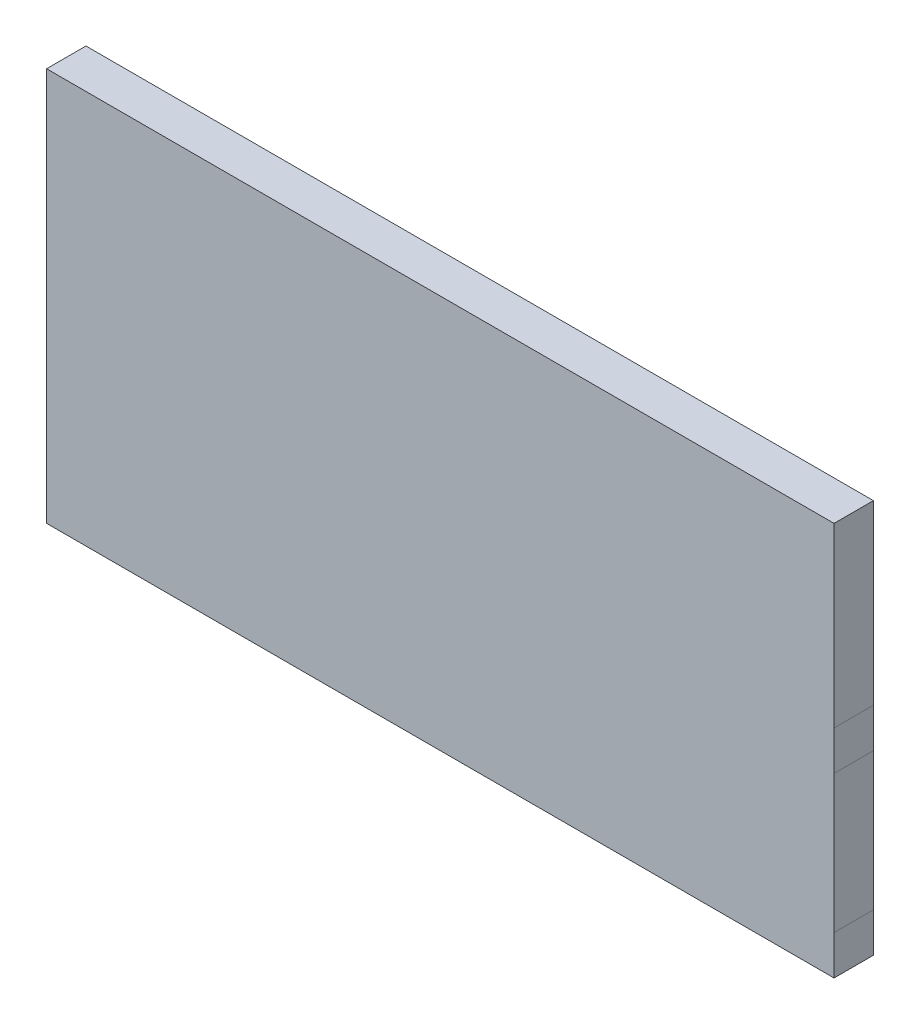
from build123d import *

# Parameters (mm, degrees)
SKETCH1_W           = 2000
SKETCH1_H           = 1000
BOSS_EXTRUDE1_DEPTH = 100


with BuildPart() as part:
    # Sketch1 → Boss-Extrude1 (new body)
    with BuildSketch(Plane.XY):
        with Locations((1000, 500)):
            Rectangle(SKETCH1_W, SKETCH1_H)
    extrude(amount=BOSS_EXTRUDE1_DEPTH)


solid = part.part
